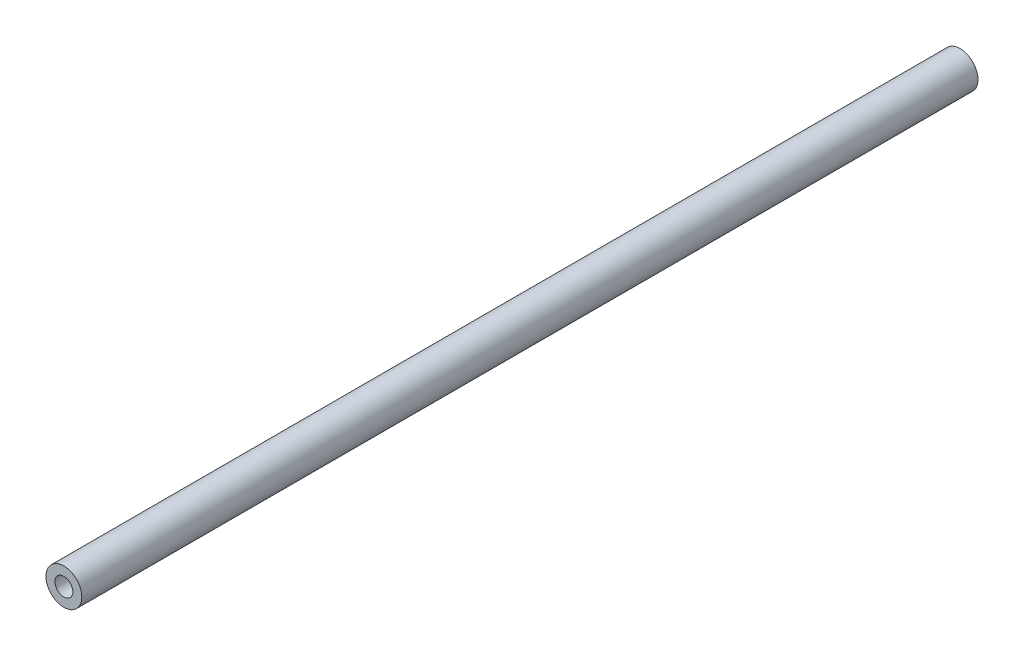
from build123d import *

# Parameters (mm, degrees)
SKETCH1_R           = 4
SKETCH1_R_2         = 2
BOSS_EXTRUDE1_DEPTH = 100


with BuildPart() as part:
    # Sketch1 → Boss-Extrude1 (new, symmetric)
    with BuildSketch(Plane.XY):
        Circle(SKETCH1_R)
        Circle(SKETCH1_R_2, mode=Mode.SUBTRACT)
    extrude(amount=BOSS_EXTRUDE1_DEPTH, both=True)


solid = part.part
